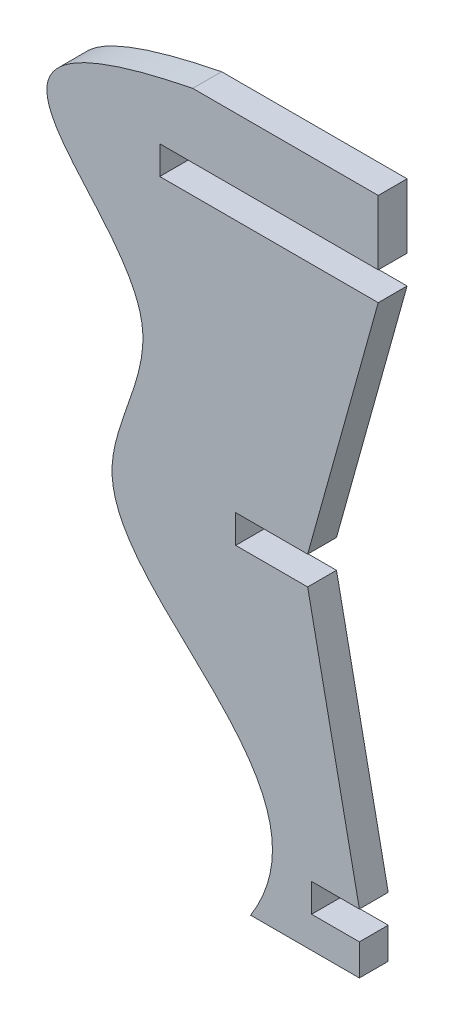
from build123d import *

# Parameters (mm, degrees)
ESTRUSIONE_ESTRUSIONE1_DEPTH = 5.7


with BuildPart() as part:
    # Model → Estrusione-Estrusione1 (new body)
    with BuildSketch(Plane.XY):
        with BuildLine():
            Line((-15.590957203, -6.098313674), (-37.075171155, -6.098313674))
            add(Edge.make_bspline(
                [(-37.075171155, -6.098313674), (-18.932670585, 22.997594141), (-82.522630452, 39.780268479), (-40.971539706, 97.496941546), (-105.285323281, 118.285278382), (-48.507865771, 129.650537837)],
                knots=[0, 0, 0, 0, 0.42870662, 0.607446095, 1, 1, 1, 1], degree=3))
            Line((-48.507865771, 129.650537837), (-11.862077277, 129.650537837))
            Line((-11.862077277, 129.650537837), (-11.862077277, 116.92))
            Line((-11.862077277, 116.92), (-55.0225, 116.92))
            Line((-55.0225, 116.92), (-55.0225, 111.31))
            Line((-55.0225, 111.31), (-11.862077277, 111.31))
            Line((-11.862077277, 111.31), (-25.805722267, 61.31))
            Line((-25.805722267, 61.31), (-40.0225, 61.31))
            Line((-40.0225, 61.31), (-40.0225, 55.7))
            Line((-40.0225, 55.7), (-25.805722267, 55.7))
            Line((-25.805722267, 55.7), (-15.590957203, 5.7))
            Line((-15.590957203, 5.7), (-25.0225, 5.7))
            Line((-25.0225, 5.7), (-25.0225, 0.09))
            Line((-25.0225, 0.09), (-15.590957203, 0.09))
            Line((-15.590957203, 0.09), (-15.590957203, -6.098313674))
        make_face()
    extrude(amount=ESTRUSIONE_ESTRUSIONE1_DEPTH)


solid = part.part
